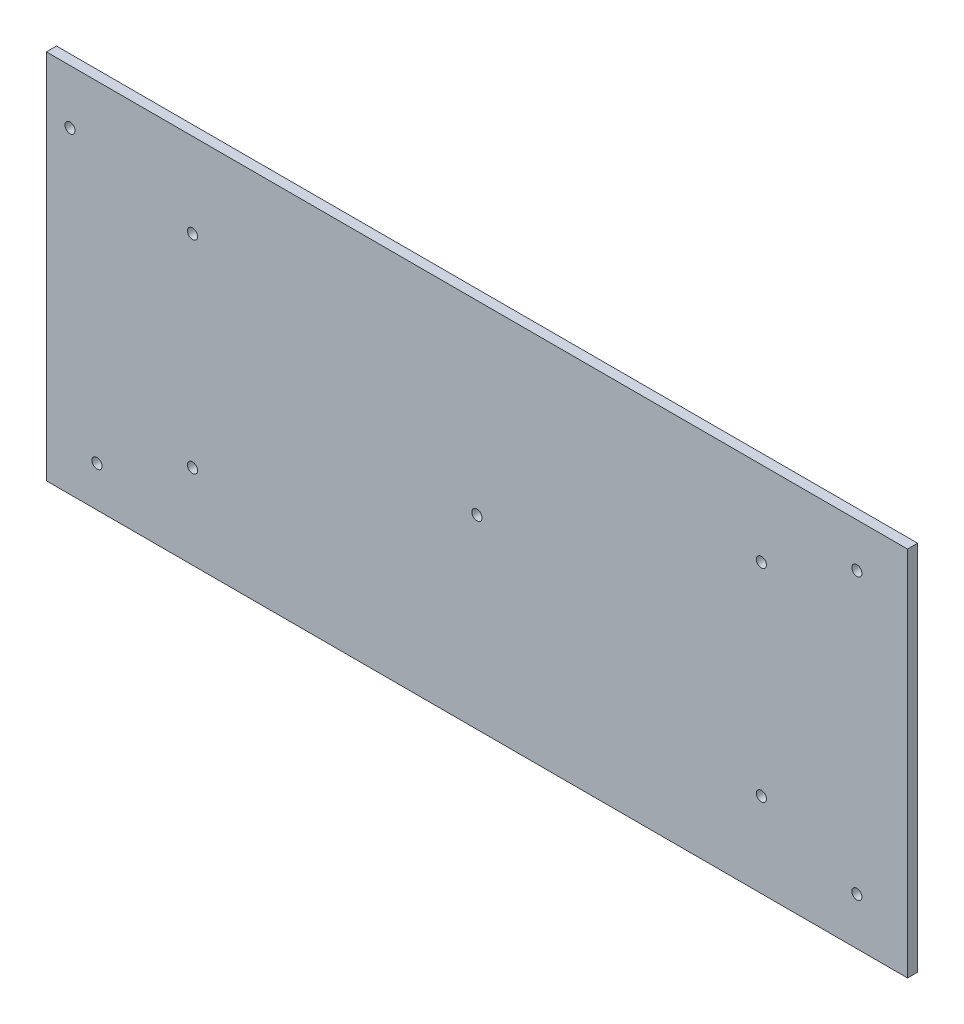
from build123d import *

# Parameters (mm, degrees)
SKETCH1_W           = 255
SKETCH1_H           = 110
SKETCH1_R           = 1.5
BOSS_EXTRUDE1_DEPTH = 3


with BuildPart() as part:
    # Sketch1 → Boss-Extrude1 (new body)
    with BuildSketch(Plane.XY):
        with Locations((-13.136363636, -6.318181818)):
            Rectangle(SKETCH1_W, SKETCH1_H)
        with Locations((-125.636363636, -49.318181818)):
            Circle(SKETCH1_R, mode=Mode.SUBTRACT)
        with Locations((-133.636363636, 32.681818182)):
            Circle(SKETCH1_R, mode=Mode.SUBTRACT)
        with Locations((99.363636364, -47.318181818)):
            Circle(SKETCH1_R, mode=Mode.SUBTRACT)
        with Locations((99.363636364, 35.681818182)):
            Circle(SKETCH1_R, mode=Mode.SUBTRACT)
        with Locations((-97.369202936, 23.681818182)):
            Circle(SKETCH1_R, mode=Mode.SUBTRACT)
        with Locations((-97.369202936, -36.318181818)):
            Circle(SKETCH1_R, mode=Mode.SUBTRACT)
        with Locations(Location((71.096475664, -36.318181818, 0), (0, 0, 180))):
            Circle(SKETCH1_R, mode=Mode.SUBTRACT)
        with Locations(Location((71.096475664, 23.681818182, 0), (0, 0, 180))):
            Circle(SKETCH1_R, mode=Mode.SUBTRACT)
        with Locations((-13.136363636, -6.318181818)):
            Circle(SKETCH1_R, mode=Mode.SUBTRACT)
    extrude(amount=BOSS_EXTRUDE1_DEPTH)


solid = part.part
